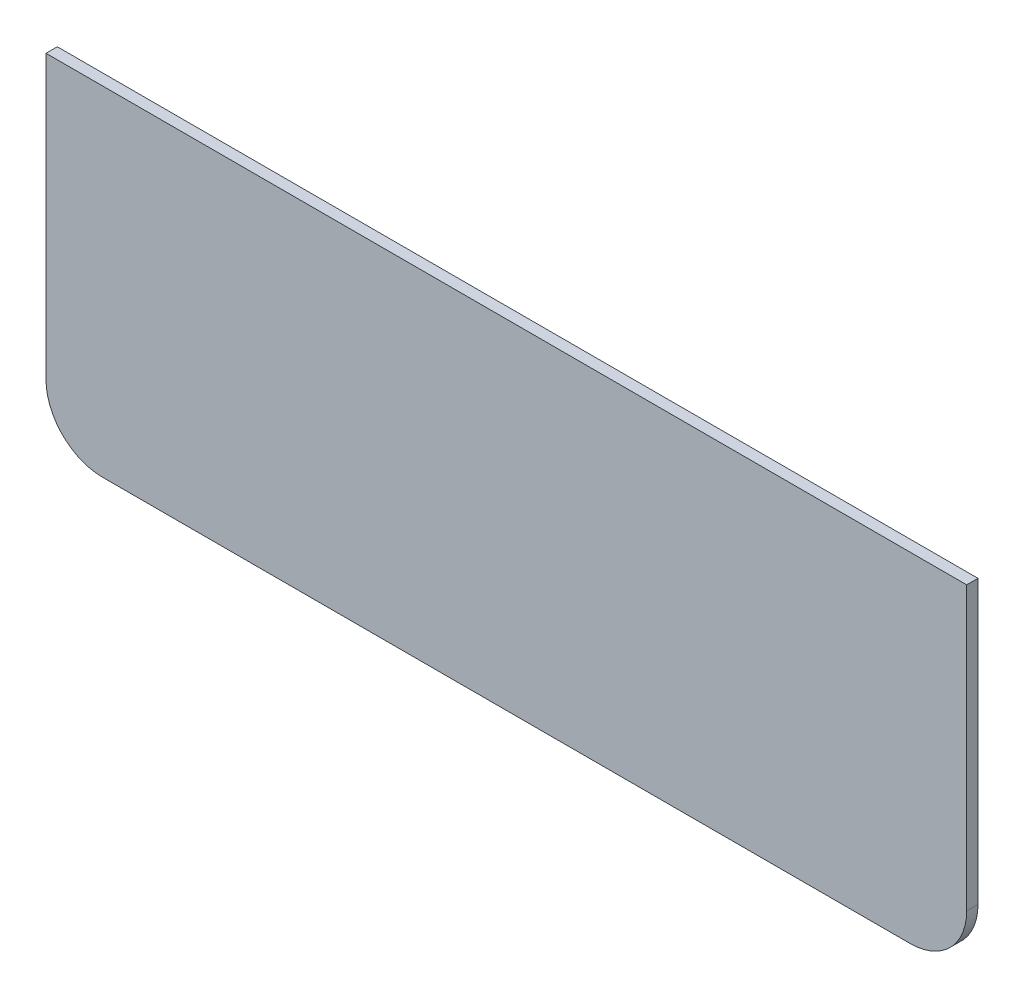
from build123d import *

# Parameters (mm, degrees)
SKETCH_1_W      = 163
SKETCH_1_H      = 60
EXTRUDE_1_DEPTH = 2
FILLET_1_R      = 10


with BuildPart() as part:
    # Эскиз1 → Бобышка-Вытянуть1 (new body)
    with BuildSketch(Plane.XY):
        Rectangle(SKETCH_1_W, SKETCH_1_H)
    extrude(amount=EXTRUDE_1_DEPTH)

    # Скругление1
    fillet_1_edges = [part.edges().sort_by_distance(p)[0] for p in [
        (81.5, -30, 1),
        (-81.5, -30, 1),
    ]]
    fillet(fillet_1_edges, radius=FILLET_1_R)


solid = part.part
